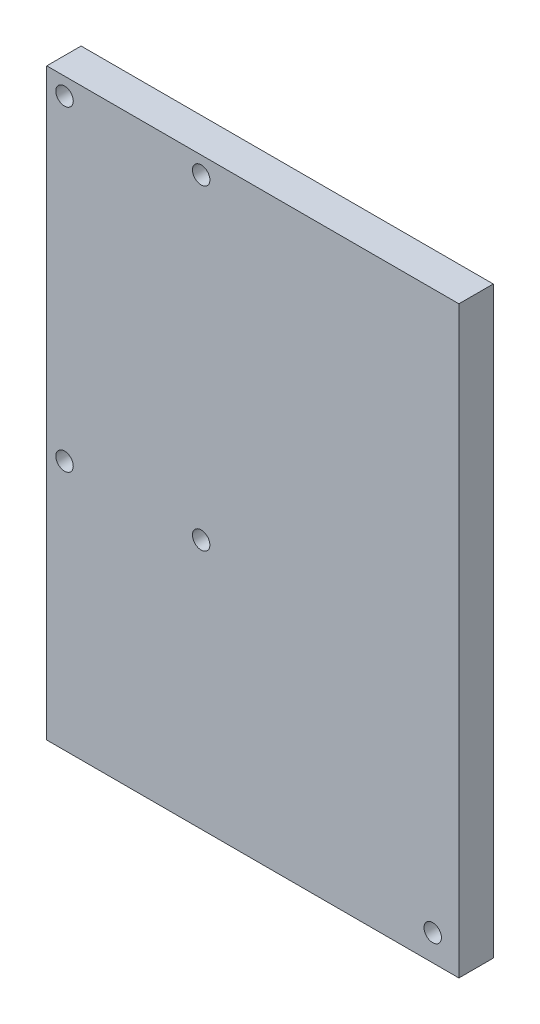
from build123d import *

# Parameters (mm, degrees)
SKETCH1_W           = 60
SKETCH1_H           = 85
BOSS_EXTRUDE1_DEPTH = 5
SKETCH2_R           = 1.27
CUT_EXTRUDE1_DEPTH  = 27


with BuildPart() as part:
    # Sketch1 → Boss-Extrude1 (new body)
    with BuildSketch(Plane.XY):
        with Locations((17.4651, -16.973)):
            Rectangle(SKETCH1_W, SKETCH1_H)
    extrude(amount=BOSS_EXTRUDE1_DEPTH)

    # Sketch2 → Cut-Extrude1 (cut)
    with BuildSketch(Plane.XY.offset(5)):
        with Locations((9.9441, -23.0124)):
            Circle(SKETCH2_R)
        with Locations((-9.9441, -23.0124)):
            Circle(SKETCH2_R)
        with Locations((-9.9441, 23.0124)):
            Circle(SKETCH2_R)
        with Locations((9.9441, 23.0124)):
            Circle(SKETCH2_R)
        with Locations((43.6551, -55.663)):
            Circle(SKETCH2_R)
    extrude(amount=-CUT_EXTRUDE1_DEPTH, mode=Mode.SUBTRACT)


solid = part.part
